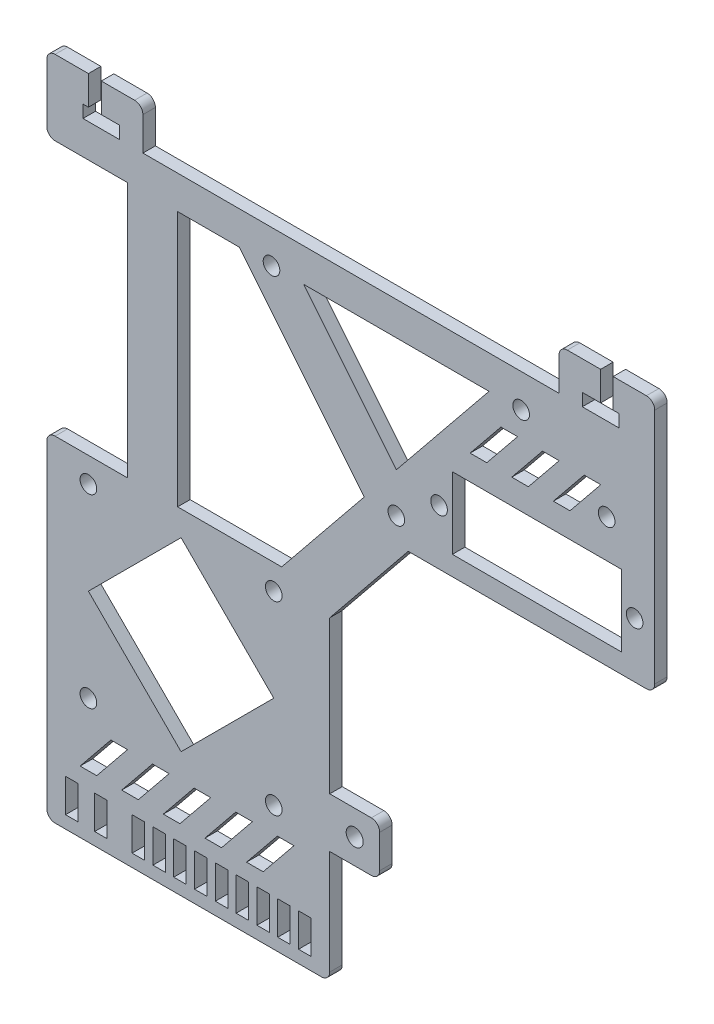
from build123d import *

# Parameters (mm, degrees)
SKETCH_1_R      = 1
SKETCH_1_R_2    = 1.025
SKETCH_1_W      = 20.3
SKETCH_1_H      = 8.6
SKETCH_1_W_2    = 1.5
SKETCH_1_H_2    = 4
EXTRUDE_1_DEPTH = 1.5
FILLET_1_R      = 1


with BuildPart() as part:
    # 草图1 → 凸台-拉伸1 (new body)
    with BuildSketch(Plane.XY):
        Polygon((-16.136931804, -26.136931804), (-16.136931804, 14.136931804), (-6.414578713, 14.136931804), (-6.414578713, 44.863068196), (-16.136931804, 44.863068196), (-16.136931804, 53.863068196), (-11.136931804, 53.863068196), (-11.136931804, 50.363068196), (-11.786931804, 50.363068196), (-11.786931804, 48.863068196), (-7.386931804, 48.863068196), (-7.386931804, 50.363068196), (-9.586931804, 50.363068196), (-9.586931804, 53.863068196), (-4.586931804, 53.863068196), (-4.586931804, 48.863068196), (45.413068196, 48.863068196), (45.413068196, 53.863068196), (50.413068196, 53.863068196), (50.413068196, 50.363068196), (48.213068196, 50.363068196), (48.213068196, 48.863068196), (50.413068196, 48.863068196), (51.913068196, 48.863068196), (52.613068196, 48.863068196), (52.613068196, 50.363068196), (51.913068196, 50.363068196), (51.913068196, 53.863068196), (56.913068196, 53.863068196), (56.913068196, 23.363068196), (27.29285372, 23.363068196), (17.863068196, 11.732999384), (17.863068196, -6.588407425), (23.863068196, -6.588407425), (23.863068196, -12.588407425), (17.863068196, -12.588407425), (17.863068196, -26.136931804), align=None)
        with Locations((11.136931804, 11.136931804)):
            Circle(SKETCH_1_R, mode=Mode.SUBTRACT)
        with Locations((31, 30)):
            Circle(SKETCH_1_R, mode=Mode.SUBTRACT)
        with Locations((54.5, 30)):
            Circle(SKETCH_1_R, mode=Mode.SUBTRACT)
        with Locations((20.863068196, -9.588407425)):
            Circle(SKETCH_1_R_2, mode=Mode.SUBTRACT)
        with Locations((25.863068196, 26.363068196)):
            Circle(SKETCH_1_R, mode=Mode.SUBTRACT)
        with Locations((40.863068196, 44.863068196)):
            Circle(SKETCH_1_R, mode=Mode.SUBTRACT)
        with Locations((10.863068196, 44.863068196)):
            Circle(SKETCH_1_R, mode=Mode.SUBTRACT)
        with Locations((51.138068196, 38.863068196)):
            Circle(SKETCH_1_R, mode=Mode.SUBTRACT)
        with Locations((11.136931804, -11.136931804)):
            Circle(SKETCH_1_R, mode=Mode.SUBTRACT)
        with Locations((-11.136931804, -11.136931804)):
            Circle(SKETCH_1_R, mode=Mode.SUBTRACT)
        with Locations((-11.136931804, 11.136931804)):
            Circle(SKETCH_1_R, mode=Mode.SUBTRACT)
        with Locations((42.75, 30)):
            Rectangle(SKETCH_1_W, SKETCH_1_H, mode=Mode.SUBTRACT)
        with Locations((-9.636931804, -22.636931804)):
            Rectangle(SKETCH_1_W_2, SKETCH_1_H_2, mode=Mode.SUBTRACT)
        with Locations((14.863068196, -22.636931804)):
            Rectangle(SKETCH_1_W_2, SKETCH_1_H_2, mode=Mode.SUBTRACT)
        with Locations((12.363068196, -22.636931804)):
            Rectangle(SKETCH_1_W_2, SKETCH_1_H_2, mode=Mode.SUBTRACT)
        with Locations((-13.136931804, -22.636931804)):
            Rectangle(SKETCH_1_W_2, SKETCH_1_H_2, mode=Mode.SUBTRACT)
        Polygon((37.00085024, 44.863068196), (14.725286152, 44.863068196), (25.863068196, 31.126470342), align=None, mode=Mode.SUBTRACT)
        with Locations((9.863068196, -22.636931804)):
            Rectangle(SKETCH_1_W_2, SKETCH_1_H_2, mode=Mode.SUBTRACT)
        with Locations((7.363068196, -22.636931804)):
            Rectangle(SKETCH_1_W_2, SKETCH_1_H_2, mode=Mode.SUBTRACT)
        with Locations((4.863068196, -22.636931804)):
            Rectangle(SKETCH_1_W_2, SKETCH_1_H_2, mode=Mode.SUBTRACT)
        with Locations((2.363068196, -22.636931804)):
            Rectangle(SKETCH_1_W_2, SKETCH_1_H_2, mode=Mode.SUBTRACT)
        with Locations((-0.136931804, -22.636931804)):
            Rectangle(SKETCH_1_W_2, SKETCH_1_H_2, mode=Mode.SUBTRACT)
        with Locations((-2.636931804, -22.636931804)):
            Rectangle(SKETCH_1_W_2, SKETCH_1_H_2, mode=Mode.SUBTRACT)
        with Locations((-5.136931804, -22.636931804)):
            Rectangle(SKETCH_1_W_2, SKETCH_1_H_2, mode=Mode.SUBTRACT)
        Polygon((-11.136931804, 0), (0, 11.136931804), (11.136931804, 0), (0, -11.136931804), align=None, mode=Mode.SUBTRACT)
        Polygon((22.00085024, 26.363068196), (12.087766679, 14.136931804), (-0.414578713, 14.136931804), (-0.414578713, 44.863068196), (7.00085024, 44.863068196), align=None, mode=Mode.SUBTRACT)
        Polygon((38.430635764, 41.863068196), (34.73085074, 37.3), (36.73085074, 37.3), (40.430635764, 41.863068196), align=None, mode=Mode.SUBTRACT)
        Polygon((43.430635764, 41.863068196), (39.73085074, 37.3), (41.73085074, 37.3), (45.430635764, 41.863068196), align=None, mode=Mode.SUBTRACT)
        Polygon((48.430635764, 41.863068196), (44.73085074, 37.3), (46.73085074, 37.3), (50.430635764, 41.863068196), align=None, mode=Mode.SUBTRACT)
        Polygon((-8.43714678, -14.136931804), (-12.136931804, -18.7), (-10.136931804, -18.7), (-6.43714678, -14.136931804), align=None, mode=Mode.SUBTRACT)
        Polygon((-3.43714678, -14.136931804), (-7.136931804, -18.7), (-5.136931804, -18.7), (-1.43714678, -14.136931804), align=None, mode=Mode.SUBTRACT)
        Polygon((1.56285322, -14.136931804), (-2.136931804, -18.7), (-0.136931804, -18.7), (3.56285322, -14.136931804), align=None, mode=Mode.SUBTRACT)
        Polygon((6.56285322, -14.136931804), (2.863068196, -18.7), (4.863068196, -18.7), (8.56285322, -14.136931804), align=None, mode=Mode.SUBTRACT)
        Polygon((11.56285322, -14.136931804), (7.863068196, -18.7), (9.863068196, -18.7), (13.56285322, -14.136931804), align=None, mode=Mode.SUBTRACT)
    extrude(amount=EXTRUDE_1_DEPTH)

    # 圆角1
    fillet_1_edges = [part.edges().sort_by_distance(p)[0] for p in [
        (-16.136931804, -26.136931804, 0.75),
        (-16.136931804, 14.136931804, 0.75),
        (-16.136931804, 44.863068196, 0.75),
        (-16.136931804, 53.863068196, 0.75),
        (-4.586931804, 53.863068196, 0.75),
        (45.413068196, 53.863068196, 0.75),
        (56.913068196, 53.863068196, 0.75),
        (56.913068196, 23.363068196, 0.75),
        (23.863068196, -6.588407425, 0.75),
        (23.863068196, -12.588407425, 0.75),
        (17.863068196, -26.136931804, 0.75),
    ]]
    fillet(fillet_1_edges, radius=FILLET_1_R)


solid = part.part
